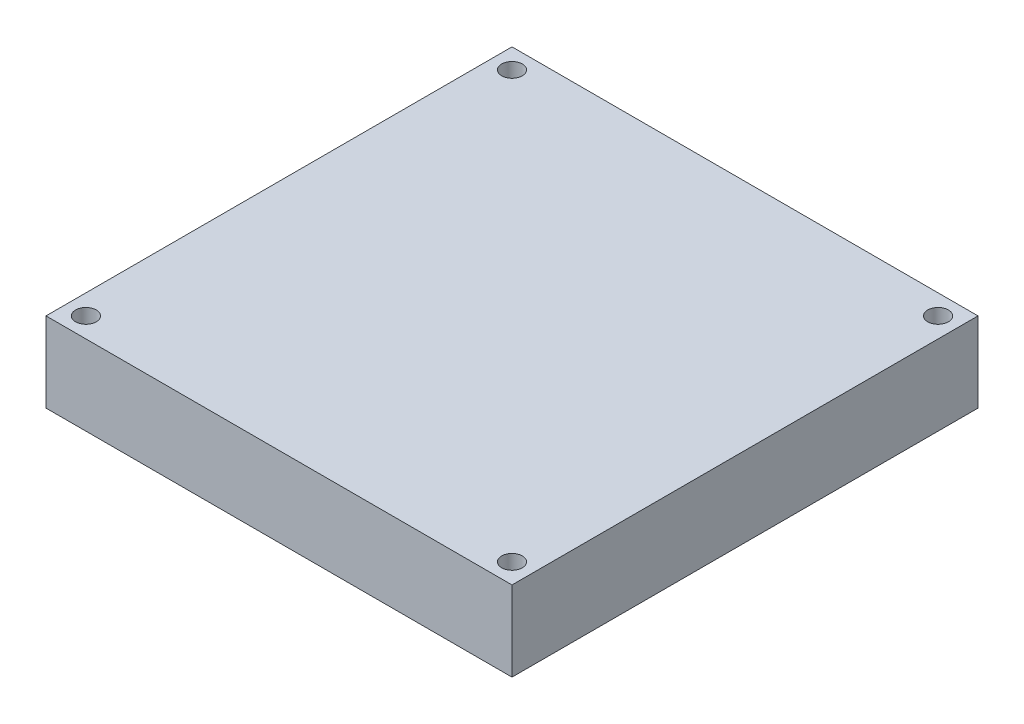
from build123d import *

# Parameters (mm, degrees)
ESBO_O1_W                = 70
ESBO_O1_H                = 70
RESSALTO_EXTRUS_O1_DEPTH = 12
ESBO_O2_R                = 1.55
CORTE_EXTRUS_O1_DEPTH    = 12


with BuildPart() as part:
    # Esboço1 → Ressalto-extrusão1 (new body)
    with BuildSketch(Plane(origin=(0, 0, 0), x_dir=(1, 0, 0), z_dir=(0, 1, 0))):
        Rectangle(ESBO_O1_W, ESBO_O1_H)
    extrude(amount=RESSALTO_EXTRUS_O1_DEPTH)

    # Esboço2 → Corte-extrusão1 (cut)
    with BuildSketch(Plane(origin=(0, 12, 0), x_dir=(1, 0, 0), z_dir=(0, 1, 0))):
        with Locations(Location((-32, 32, 0), (0, 0, 270))):
            Circle(ESBO_O2_R)
        with Locations(Location((32, 32, 0), (0, 0, 90))):
            Circle(ESBO_O2_R)
        with Locations(Location((32, -32, 0), (0, 0, 270))):
            Circle(ESBO_O2_R)
        with Locations(Location((-32, -32, 0), (0, 0, 90))):
            Circle(ESBO_O2_R)
    extrude(amount=-CORTE_EXTRUS_O1_DEPTH, mode=Mode.SUBTRACT)


solid = part.part
